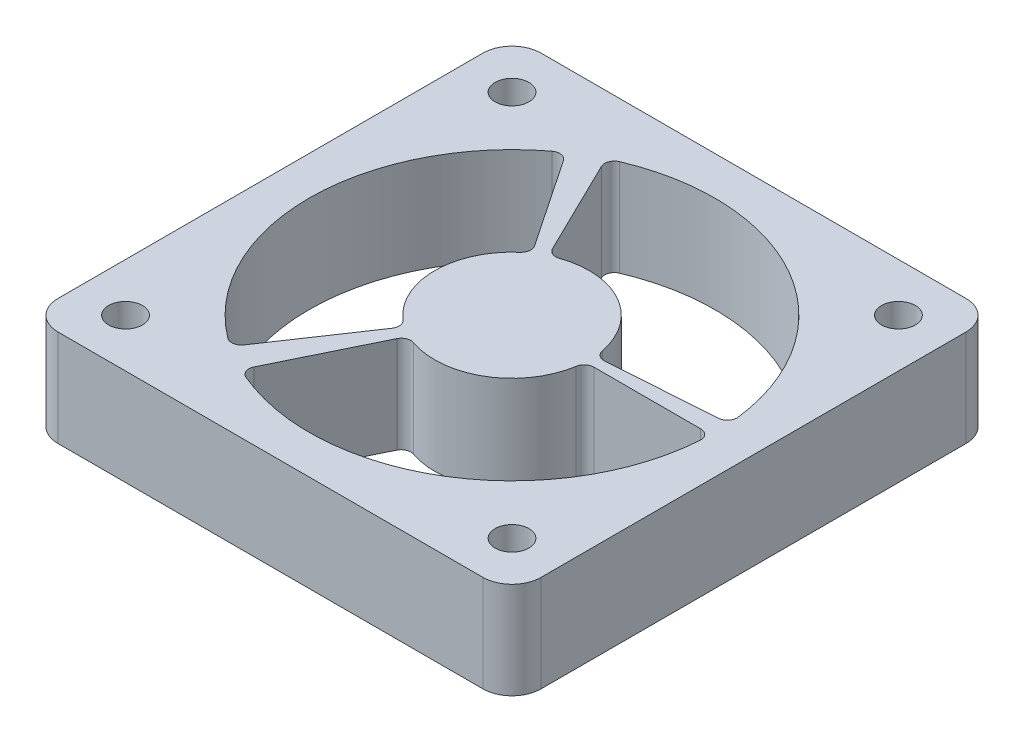
from build123d import *

# Parameters (mm, degrees)
DODANIE_WYCI_GNI_CIE1_DEPTH = 10
SZKIC2_R                    = 1.75
WYTNIJ_WYCI_GNI_CIE1_DEPTH  = 10


with BuildPart() as part:
    # Szkic1 → Dodanie-wyciągnięcie1 (new body)
    with BuildSketch(Plane(origin=(0, 0, 0), x_dir=(1, 0, 0), z_dir=(0, 1, 0))):
        with BuildLine():
            Line((22, -25), (-22, -25))
            ThreePointArc((-22, -25), (-24.121320344, -24.121320344), (-25, -22))
            Line((-25, -22), (-25, 22))
            ThreePointArc((-25, 22), (-24.121320344, 24.121320344), (-22, 25))
            Line((-22, 25), (22, 25))
            ThreePointArc((22, 25), (24.121320344, 24.121320344), (25, 22))
            Line((25, 22), (25, -22))
            ThreePointArc((25, -22), (24.121320344, -24.121320344), (22, -25))
        make_face()
    extrude(amount=DODANIE_WYCI_GNI_CIE1_DEPTH)

    # Szkic2 → Wytnij-wyciągnięcie1 (cut)
    with BuildSketch(Plane(origin=(0, 10, 0), x_dir=(1, 0, 0), z_dir=(0, 1, 0))):
        with Locations(Location((-20, 20, 0), (0, 0, 270))):
            Circle(SZKIC2_R)
        with Locations(Location((20, 20, 0), (0, 0, 270))):
            Circle(SZKIC2_R)
        with Locations(Location((20, -20, 0), (0, 0, 270))):
            Circle(SZKIC2_R)
        with Locations(Location((-20, -20, 0), (0, 0, 270))):
            Circle(SZKIC2_R)
        with BuildLine():
            Line((19.949804326, -0.416088747), (8.887895851, -0.416088747))
            ThreePointArc((8.887895851, -0.416088747), (8.238797705, -0.655384076), (7.900351868, -1.258745553))
            ThreePointArc((7.900351868, -1.258745553), (4.101739563, -6.868459256), (-2.638482905, -7.552377636))
            ThreePointArc((-2.638482905, -7.552377636), (-3.348489276, -7.571518902), (-3.866696101, -8.057252494))
            Line((-3.866696101, -8.057252494), (-8.71289149, -17.970981564))
            ThreePointArc((-8.71289149, -17.970981564), (-8.751315605, -18.759947091), (-8.20521309, -19.330661607))
            ThreePointArc((-8.20521309, -19.330661607), (10.963128103, -17.911164736), (20.947294543, -1.486893185))
            ThreePointArc((20.947294543, -1.486893185), (20.681516168, -0.734474647), (19.949804326, -0.416088747))
        make_face()
        with BuildLine():
            Line((19.918829975, 1.449846448), (8.910113622, 0.686816973))
            ThreePointArc((8.910113622, 0.686816973), (8.230490402, 0.892390127), (7.858638328, 1.497265385))
            ThreePointArc((7.858638328, 1.497265385), (3.997324324, 6.929747344), (-2.638482905, 7.552377636))
            ThreePointArc((-2.638482905, 7.552377636), (-3.348489276, 7.571518902), (-3.866696101, 8.057252494))
            Line((-3.866696101, 8.057252494), (-8.71289149, 17.970981564))
            ThreePointArc((-8.71289149, 17.970981564), (-8.751315605, 18.759947091), (-8.20521309, 19.330661607))
            ThreePointArc((-8.20521309, 19.330661607), (10.495454585, 18.189157019), (20.842168696, 2.569825685))
            ThreePointArc((20.842168696, 2.569825685), (20.621275551, 1.81133417), (19.918829975, 1.449846448))
        make_face()
        with BuildLine():
            Line((-11.206880821, -16.531076152), (-5.044437294, -7.377283299))
            ThreePointArc((-5.044437294, -7.377283299), (-4.882883076, -6.685636228), (-5.221309439, -6.061182041))
            ThreePointArc((-5.221309439, -6.061182041), (-8, 0), (-5.221309439, 6.061182041))
            ThreePointArc((-5.221309439, 6.061182041), (-4.882883076, 6.685636228), (-5.044437294, 7.377283299))
            Line((-5.044437294, 7.377283299), (-11.206880821, 16.531076152))
            ThreePointArc((-11.206880821, 16.531076152), (-11.870932952, 16.958835176), (-12.638237478, 16.771253783))
            ThreePointArc((-12.638237478, 16.771253783), (-21, 0), (-12.638237478, -16.771253783))
            ThreePointArc((-12.638237478, -16.771253783), (-11.870932952, -16.958835176), (-11.206880821, -16.531076152))
        make_face()
    extrude(amount=-WYTNIJ_WYCI_GNI_CIE1_DEPTH, mode=Mode.SUBTRACT)


solid = part.part
